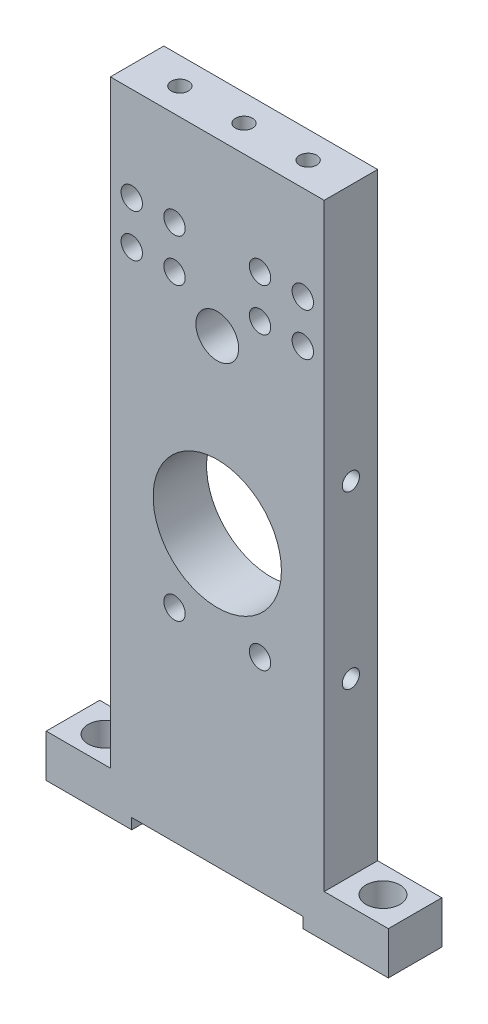
from build123d import *

# Parameters (mm, degrees)
SKETCH1_W                        = 101.6
SKETCH1_H                        = 15.875
BOSS_EXTRUDE1_DEPTH              = 190.5
CUT_EXTRUDE1_REACH               = 199.795
SKETCH2_W                        = 19.05
SKETCH2_H                        = 177.8
CUT_EXTRUDE2_REACH               = 199.795
SKETCH4_W                        = 50.8
SKETCH4_H                        = 3.175
F_3_8_CLEARANCE_HOLE1_D          = 10.0838
F_3_8_CLEARANCE_HOLE1_DEPTH      = 38.608
F_3_8_CLEARANCE_HOLE1_TIP        = 3.029479155
F_1_4_0_25_DIAMETER_HOLE2_D      = 6.35
CUT_EXTRUDE3_REACH               = 199.795
SKETCH11_R                       = 19.05
F_1_4_20_TAPPED_HOLE2_D          = 5.1054
F_1_4_20_TAPPED_HOLE2_DEPTH      = 18.542
F_1_4_20_TAPPED_HOLE2_TIP        = 1.533816902
LPATTERN1_COUNT                  = 2
LPATTERN1_PITCH                  = 12.7
F_1_4_0_25_DIAMETER_HOLE1_D      = 6.35
F_1_4_0_25_DIAMETER_HOLE1_DEPTH  = 38.608
F_1_4_0_25_DIAMETER_HOLE1_TIP    = 1.907732465
F_1_4_20_TAPPED_HOLE3_AT_2_COUNT = 2
F_1_4_20_TAPPED_HOLE3_AT_2_PITCH = 50.8
CUT_EXTRUDE4_REACH               = 199.795
SKETCH19_R                       = 6.35
MIRROR3_COPY_1_D                 = 6.35


with BuildPart() as part:
    # Sketch1 → Boss-Extrude1 (new body)
    with BuildSketch(Plane(origin=(0, 0, 0), x_dir=(1, 0, 0), z_dir=(0, 1, 0))):
        Rectangle(SKETCH1_W, SKETCH1_H)
    extrude(amount=BOSS_EXTRUDE1_DEPTH)

    # Sketch2 → Cut-Extrude1 (cut, up to next)
    with BuildSketch(Plane.XY.offset(7.9375), mode=Mode.PRIVATE) as cut_extrude1_sk1:
        with Locations((-41.275, 101.6)):
            Rectangle(SKETCH2_W, SKETCH2_H)
    cut_extrude1_tool1 = extrude(cut_extrude1_sk1.sketch, amount=-CUT_EXTRUDE1_REACH, mode=Mode.PRIVATE) & part.part
    # Sketch2 → Cut-Extrude1 (cut, up to next)
    with BuildSketch(Plane.XY.offset(7.9375), mode=Mode.PRIVATE) as cut_extrude1_sk2:
        with Locations((41.275, 101.6)):
            Rectangle(SKETCH2_W, SKETCH2_H)
    cut_extrude1_tool2 = extrude(cut_extrude1_sk2.sketch, amount=-CUT_EXTRUDE1_REACH, mode=Mode.PRIVATE) & part.part
    add(cut_extrude1_tool1.solids().sort_by_distance((-41.275, 101.6, 7.9375))[0], mode=Mode.SUBTRACT)
    add(cut_extrude1_tool2.solids().sort_by_distance((41.275, 101.6, 7.9375))[0], mode=Mode.SUBTRACT)

    # Sketch4 → Cut-Extrude2 (cut, up to next)
    with BuildSketch(Plane.XY.offset(7.9375), mode=Mode.PRIVATE) as cut_extrude2_sk1:
        with Locations((0, 1.5875)):
            Rectangle(SKETCH4_W, SKETCH4_H)
    cut_extrude2_tool1 = extrude(cut_extrude2_sk1.sketch, amount=-CUT_EXTRUDE2_REACH, mode=Mode.PRIVATE) & part.part
    add(cut_extrude2_tool1.solids().sort_by_distance((0, 1.5875, 7.9375))[0], mode=Mode.SUBTRACT)

    # 3/8 Clearance Hole1
    with Locations(Plane(origin=(0, 12.7, 0), x_dir=(-1, 0, 0), z_dir=(0, 1, 0))):
        with Locations((41.275, 0), (-41.275, 0)):
            Hole(F_3_8_CLEARANCE_HOLE1_D / 2, depth=F_3_8_CLEARANCE_HOLE1_DEPTH)
            with Locations((0, 0, -(F_3_8_CLEARANCE_HOLE1_DEPTH + F_3_8_CLEARANCE_HOLE1_TIP / 2))):  # 118° drill point
                Cone(0, F_3_8_CLEARANCE_HOLE1_D / 2, F_3_8_CLEARANCE_HOLE1_TIP, mode=Mode.SUBTRACT)

    # 1/4 (0.25) Diameter Hole2 (through all)
    with Locations(Plane.XY.offset(7.9375)):
        with Locations((12.7, 149.86), (25.4, 149.86)):
            f_1_4_0_25_diameter_hole2 = Hole(F_1_4_0_25_DIAMETER_HOLE2_D / 2)

    # Sketch11 → Cut-Extrude3 (cut, up to next)
    with BuildSketch(Plane.XY.offset(7.9375), mode=Mode.PRIVATE) as cut_extrude3_sk1:
        with Locations((0, 88.9)):
            Circle(SKETCH11_R)
    cut_extrude3_tool1 = extrude(cut_extrude3_sk1.sketch, amount=-CUT_EXTRUDE3_REACH, mode=Mode.PRIVATE) & part.part
    add(cut_extrude3_tool1.solids().sort_by_distance((0, 88.9, 7.9375))[0], mode=Mode.SUBTRACT)

    # 1/4-20 Tapped Hole2
    with Locations(Plane(origin=(0, 190.5, 0), x_dir=(1, 0, 0), z_dir=(0, 1, 0))):
        with Locations((-19.05, 0), (19.05, 0), (0, 0)):
            Hole(F_1_4_20_TAPPED_HOLE2_D / 2, depth=F_1_4_20_TAPPED_HOLE2_DEPTH)
            with Locations((0, 0, -(F_1_4_20_TAPPED_HOLE2_DEPTH + F_1_4_20_TAPPED_HOLE2_TIP / 2))):  # 118° drill point
                Cone(0, F_1_4_20_TAPPED_HOLE2_D / 2, F_1_4_20_TAPPED_HOLE2_TIP, mode=Mode.SUBTRACT)

    # LPattern1: 1/4 (0.25) Diameter Hole2 ×2
    with Locations(*[(0, i * LPATTERN1_PITCH, 0) for i in range(1, LPATTERN1_COUNT)]):
        add(f_1_4_0_25_diameter_hole2, mode=Mode.SUBTRACT)

    # 1/4 (0.25) Diameter Hole1
    with Locations(Plane.XY.offset(7.9375)):
        with Locations((-12.7, 63.5), (12.7, 63.5)):
            Hole(F_1_4_0_25_DIAMETER_HOLE1_D / 2, depth=F_1_4_0_25_DIAMETER_HOLE1_DEPTH)
            with Locations((0, 0, -(F_1_4_0_25_DIAMETER_HOLE1_DEPTH + F_1_4_0_25_DIAMETER_HOLE1_TIP / 2))):  # 118° drill point
                Cone(0, F_1_4_0_25_DIAMETER_HOLE1_D / 2, F_1_4_0_25_DIAMETER_HOLE1_TIP, mode=Mode.SUBTRACT)

    # Sketch17 → 1/4-20 Tapped Hole3 (revolve, cut)
    with BuildSketch(Plane(origin=(31.75, 114.3, 0), x_dir=(0, 0, -1), z_dir=(0, 1, 0))):
        Polygon((0, 0), (0, 20.075816902), (2.5527, 18.542), (2.5527, 0), align=None)
    f_1_4_20_tapped_hole3 = revolve(axis=Axis((38.1, 114.3, 0), (-1, 0, 0)), mode=Mode.SUBTRACT)

    # 1/4-20 Tapped Hole3 at 2: 1/4-20 Tapped Hole3 ×2
    with Locations(*[(0, -i * F_1_4_20_TAPPED_HOLE3_AT_2_PITCH, 0) for i in range(1, F_1_4_20_TAPPED_HOLE3_AT_2_COUNT)]):
        add(f_1_4_20_tapped_hole3, mode=Mode.SUBTRACT)

    # Mirror2: 1/4-20 Tapped Hole3 across plane
    add(f_1_4_20_tapped_hole3.mirror(Plane(origin=(0, 0, 0), x_dir=(0, 0, 1), z_dir=(1, 0, 0))), mode=Mode.SUBTRACT)

    # Mirror2 copy 1 sketch → Mirror2 copy 1 (revolve, cut)
    with BuildSketch(Plane(origin=(-31.75, 63.5, 0), x_dir=(0, 0, -1), z_dir=(0, 1, 0))):
        Polygon((0, 0), (0, -20.075816902), (2.5527, -18.542), (2.5527, 0), align=None)
    revolve(axis=Axis((-38.1, 63.5, 0), (-1, 0, 0)), mode=Mode.SUBTRACT)

    # Sketch19 → Cut-Extrude4 (cut, up to next)
    with BuildSketch(Plane.XY.offset(7.9375), mode=Mode.PRIVATE) as cut_extrude4_sk1:
        with Locations((0, 139.7)):
            Circle(SKETCH19_R)
    cut_extrude4_tool1 = extrude(cut_extrude4_sk1.sketch, amount=-CUT_EXTRUDE4_REACH, mode=Mode.PRIVATE) & part.part
    add(cut_extrude4_tool1.solids().sort_by_distance((0, 139.7, 7.9375))[0], mode=Mode.SUBTRACT)

    # Mirror3: 1/4 (0.25) Diameter Hole2 across plane
    add(f_1_4_0_25_diameter_hole2.mirror(Plane(origin=(0, 0, 0), x_dir=(0, 0, 1), z_dir=(1, 0, 0))), mode=Mode.SUBTRACT)

    # Mirror3 copy 1 (through all)
    with Locations(Plane(origin=(0, 12.7, 7.9375), x_dir=(-1, 0, 0), z_dir=(0, 0, 1))):
        with Locations((12.7, -149.86), (25.4, -149.86)):
            Hole(MIRROR3_COPY_1_D / 2)


solid = part.part
